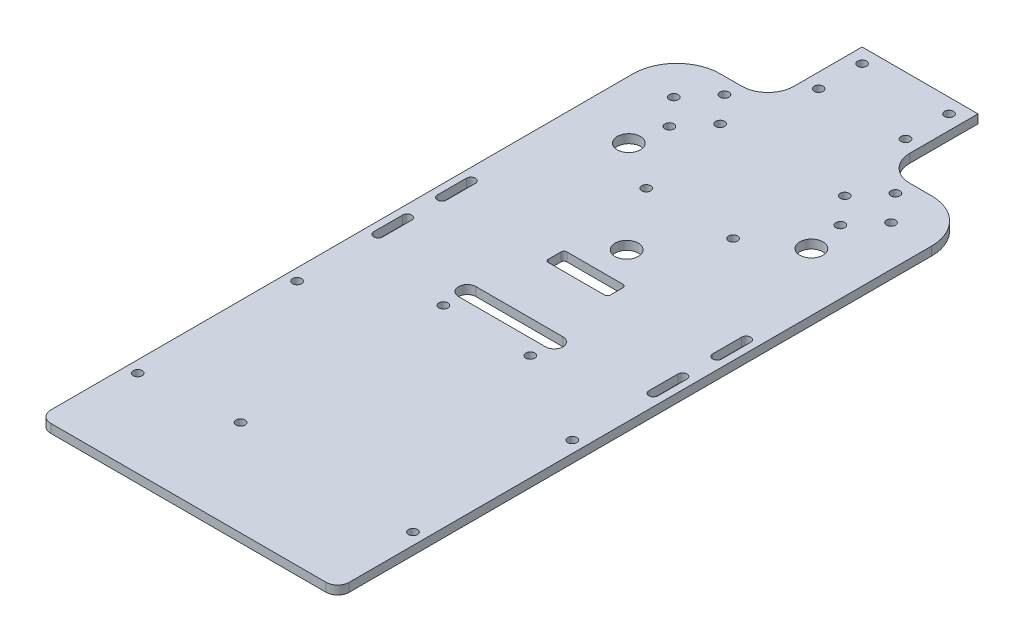
from build123d import *

# Parameters (mm, degrees)
SKETCH_1_W              = 200
SKETCH_1_H              = 200
EXTRUDE_1_DEPTH         = 3
SKETCH_2_R              = 1.55
CUT_EXTRUDE_2_DEPTH     = 10
CUT_EXTRUDE_3_DEPTH     = 10
SKETCH_6_R              = 1.55
CUT_EXTRUDE_3_1_1_DEPTH = 10
SKETCH_9_R              = 4
CUT_EXTRUDE_5184_DEPTH  = 113.522220028
EXTRUDE_2_DEPTH         = 30
CUT_EXTRUDE_2006_REACH  = 141.862
SKETCH_10_R             = 4
CUT_EXTRUDE_6949_REACH  = 141.862
CUT_EXTRUDE_4_DEPTH     = 10
SKETCH_13_W             = 103
SKETCH_13_H             = 3
EXTRUDE_3_DEPTH         = 75
CUT_EXTRUDE_7474_DEPTH  = 10
HOLE_WIZARD_3_1_3_1_1_D = 3.1
FILLET_1_R              = 4
HOLE_WIZARD_3_1_3_1_2_D = 3.1


with BuildPart() as part:
    # 草图1 → 凸台-拉伸1 (new body)
    with BuildSketch(Plane(origin=(0, 0, 0), x_dir=(1, 0, 0), z_dir=(0, 1, 0))):
        Rectangle(SKETCH_1_W, SKETCH_1_H)
    extrude(amount=EXTRUDE_1_DEPTH)

    # 草图2 → 切除-拉伸2 (cut)
    with BuildSketch(Plane(origin=(0, 3, 0), x_dir=(1, 0, 0), z_dir=(0, 1, 0))):
        with Locations(Location((29.5, 9.5, 0), (0, 0, 270))):
            Circle(SKETCH_2_R)
        with Locations(Location((21.5, 0, 0), (0, 0, 270))):
            Circle(SKETCH_2_R)
        with Locations(Location((29.5, -9.5, 0), (0, 0, 270))):
            Circle(SKETCH_2_R)
        with Locations(Location((37.5, 0, 0), (0, 0, 270))):
            Circle(SKETCH_2_R)
        with Locations(Location((-29.5, -9.5, 0), (0, 0, 270))):
            Circle(SKETCH_2_R)
        with Locations(Location((-37.5, 0, 0), (0, 0, 270))):
            Circle(SKETCH_2_R)
        with Locations(Location((-21.5, 0, 0), (0, 0, 270))):
            Circle(SKETCH_2_R)
        with Locations(Location((-29.5, 9.5, 0), (0, 0, 270))):
            Circle(SKETCH_2_R)
        with Locations(Location((-15, -32, 0), (0, 0, 270))):
            Circle(SKETCH_2_R)
        with Locations(Location((15, -32, 0), (0, 0, 270))):
            Circle(SKETCH_2_R)
    extrude(amount=-CUT_EXTRUDE_2_DEPTH, mode=Mode.SUBTRACT)

    # 草图5 → 切除-拉伸3 (cut)
    with BuildSketch(Plane(origin=(0, 3, 0), x_dir=(1, 0, 0), z_dir=(0, 1, 0))):
        with BuildLine():
            Line((51.5, -0.0030003), (51.5, -100))
            Line((51.5, -100), (100, -100))
            Line((100, -100), (100, 100))
            Line((100, 100), (-100, 100))
            Line((-100, 100), (-100, -100))
            Line((-100, -100), (-51.5, -100))
            Line((-51.5, -100), (-51.5, -0.0030003))
            ThreePointArc((-51.5, -0.0030003), (-47.106601718, 10.603601418), (-36.5, 14.9969997))
            Line((-36.5, 14.9969997), (-29, 14.9969997))
            ThreePointArc((-29, 14.9969997), (-22.636038969, 17.633038669), (-20, 23.9969997))
            Line((-20, 23.9969997), (-20, 24.9949995))
            Line((-20, 24.9949995), (-20, 47.5))
            Line((-20, 47.5), (0, 47.5))
            Line((0, 47.5), (20, 47.5))
            Line((20, 47.5), (20, 24.9949995))
            Line((20, 24.9949995), (20, 23.9969997))
            ThreePointArc((20, 23.9969997), (22.636038969, 17.633038669), (29, 14.9969997))
            Line((29, 14.9969997), (36.5, 14.9969997))
            ThreePointArc((36.5, 14.9969997), (47.106601718, 10.603601418), (51.5, -0.0030003))
        make_face()
    extrude(amount=-CUT_EXTRUDE_3_DEPTH, mode=Mode.SUBTRACT)

    # 草图6 → φ3.1通孔1 (cut)
    with BuildSketch(Plane.XZ):
        with Locations(Location((-15, -42.5, 0), (0, 0, 270))):
            Circle(SKETCH_6_R)
        with Locations(Location((-15, -27.5, 0), (0, 0, 270))):
            Circle(SKETCH_6_R)
        with Locations(Location((15, -27.5, 0), (0, 0, 90))):
            Circle(SKETCH_6_R)
        with Locations(Location((15, -42.5, 0), (0, 0, 90))):
            Circle(SKETCH_6_R)
    extrude(amount=-CUT_EXTRUDE_3_1_1_DEPTH, mode=Mode.SUBTRACT)

    # 草图9 → Cut-Extrude 5184 (cut, through all)
    with BuildSketch(Plane(origin=(0, 3, 0), x_dir=(1, 0, 0), z_dir=(0, 1, 0))):
        with Locations(Location((0, -53.75, 0), (0, 0, 270))):
            Circle(SKETCH_9_R)
    extrude(amount=-CUT_EXTRUDE_5184_DEPTH, mode=Mode.SUBTRACT)

    # 草图11 → 凸台-拉伸2 (add)
    with BuildSketch(Plane.XY.offset(100)):
        Polygon((-44.5, 3), (-51.5, 3), (-51.5, 0), (-44.5, 0), (44.5, 0), (51.5, 0), (51.5, 3), (44.5, 3), align=None)
    extrude(amount=EXTRUDE_2_DEPTH)

    # 草图10 → 2006电机穿线孔 (cut, up to next)
    with BuildSketch(Plane.XZ, mode=Mode.PRIVATE) as cut_extrude_2006_sk1:
        with Locations(Location((-31.5, 21.5, 0), (0, 0, 270))):
            Circle(SKETCH_10_R)
    cut_extrude_2006_tool1 = extrude(cut_extrude_2006_sk1.sketch, amount=-CUT_EXTRUDE_2006_REACH, mode=Mode.PRIVATE) & part.part
    # 草图10 → 2006电机穿线孔 (cut, up to next)
    with BuildSketch(Plane.XZ, mode=Mode.PRIVATE) as cut_extrude_2006_sk2:
        with Locations(Location((31.5, 21.5, 0), (0, 0, 270))):
            Circle(SKETCH_10_R)
    cut_extrude_2006_tool2 = extrude(cut_extrude_2006_sk2.sketch, amount=-CUT_EXTRUDE_2006_REACH, mode=Mode.PRIVATE) & part.part
    add(cut_extrude_2006_tool1.solids().sort_by_distance((-31.5, 0, 21.5))[0], mode=Mode.SUBTRACT)
    add(cut_extrude_2006_tool2.solids().sort_by_distance((31.5, 0, 21.5))[0], mode=Mode.SUBTRACT)

    # 草图12 → Cut-Extrude 6949 (cut, up to next)
    with BuildSketch(Plane(origin=(0, 3, 0), x_dir=(1, 0, 0), z_dir=(0, 1, 0)), mode=Mode.PRIVATE) as cut_extrude_6949_sk1:
        with BuildLine():
            Line((-9.7, -64.7), (9.7, -64.7))
            ThreePointArc((9.7, -64.7), (10.407106781, -64.992893219), (10.7, -65.7))
            Line((10.7, -65.7), (10.7, -70.08))
            ThreePointArc((10.7, -70.08), (10.407106781, -70.787106781), (9.7, -71.08))
            Line((9.7, -71.08), (-9.7, -71.08))
            ThreePointArc((-9.7, -71.08), (-10.407106781, -70.787106781), (-10.7, -70.08))
            Line((-10.7, -70.08), (-10.7, -65.7))
            ThreePointArc((-10.7, -65.7), (-10.407106781, -64.992893219), (-9.7, -64.7))
        make_face()
    cut_extrude_6949_tool1 = extrude(cut_extrude_6949_sk1.sketch, amount=-CUT_EXTRUDE_6949_REACH, mode=Mode.PRIVATE) & part.part
    add(cut_extrude_6949_tool1.solids().sort_by_distance((0, 3, 67.89))[0], mode=Mode.SUBTRACT)

    # 草图7 → 切除-拉伸4 (cut)
    with BuildSketch(Plane(origin=(0, 3, 0), x_dir=(1, 0, 0), z_dir=(0, 1, 0))):
        with BuildLine():
            Line((-49.05, -70), (-49.05, -60))
            ThreePointArc((-49.05, -60), (-47.5, -58.45), (-45.95, -60))
            Line((-45.95, -60), (-45.95, -70))
            ThreePointArc((-45.95, -70), (-47.5, -71.55), (-49.05, -70))
        make_face()
        with BuildLine():
            Line((-49.05, -92), (-49.05, -82))
            ThreePointArc((-49.05, -82), (-47.5, -80.45), (-45.95, -82))
            Line((-45.95, -82), (-45.95, -92))
            ThreePointArc((-45.95, -92), (-47.5, -93.55), (-49.05, -92))
        make_face()
        with BuildLine():
            Line((45.95, -92), (45.95, -82))
            ThreePointArc((45.95, -82), (47.5, -80.45), (49.05, -82))
            Line((49.05, -82), (49.05, -92))
            ThreePointArc((49.05, -92), (47.5, -93.55), (45.95, -92))
        make_face()
        with BuildLine():
            Line((45.95, -70), (45.95, -60))
            ThreePointArc((45.95, -60), (47.5, -58.45), (49.05, -60))
            Line((49.05, -60), (49.05, -70))
            ThreePointArc((49.05, -70), (47.5, -71.55), (45.95, -70))
        make_face()
    extrude(amount=-CUT_EXTRUDE_4_DEPTH, mode=Mode.SUBTRACT)

    # 草图13 → 凸台-拉伸3 (add)
    with BuildSketch(Plane.XY.offset(130)):
        with Locations((0, 1.5)):
            Rectangle(SKETCH_13_W, SKETCH_13_H)
    extrude(amount=EXTRUDE_3_DEPTH)

    # 草图14 → Cut-Extrude 7474 (cut)
    with BuildSketch(Plane(origin=(0, 3, 0), x_dir=(1, 0, 0), z_dir=(0, 1, 0))):
        with BuildLine():
            Line((-15, -90.75), (15, -90.75))
            ThreePointArc((15, -90.75), (18, -93.75), (15, -96.75))
            Line((15, -96.75), (-15, -96.75))
            ThreePointArc((-15, -96.75), (-18, -93.75), (-15, -90.75))
        make_face()
    extrude(amount=-CUT_EXTRUDE_7474_DEPTH, mode=Mode.SUBTRACT)

    # Ø3.1 (3.1) 直径孔1 (through all)
    with Locations(Plane(origin=(-47.5, 3, 120), x_dir=(0, 0, 1), z_dir=(0, 1, 0))):
        with Locations((0, 0), (0, 95), (55, 0), (55, 95)):
            Hole(HOLE_WIZARD_3_1_3_1_1_D / 2)

    # 圆角1
    fillet_1_edges = [part.edges().sort_by_distance(p)[0] for p in [
        (-51.5, 1.5, 205),
        (51.5, 1.5, 205),
    ]]
    fillet(fillet_1_edges, radius=FILLET_1_R)

    # Ø3.1 (3.1) 直径孔2 (through all)
    with Locations(Plane(origin=(-15, 3, 102), x_dir=(0, 0, 1), z_dir=(0, 1, 0))):
        with Locations((0, 0), (0, 30), (70, 0)):
            Hole(HOLE_WIZARD_3_1_3_1_2_D / 2)


solid = part.part
